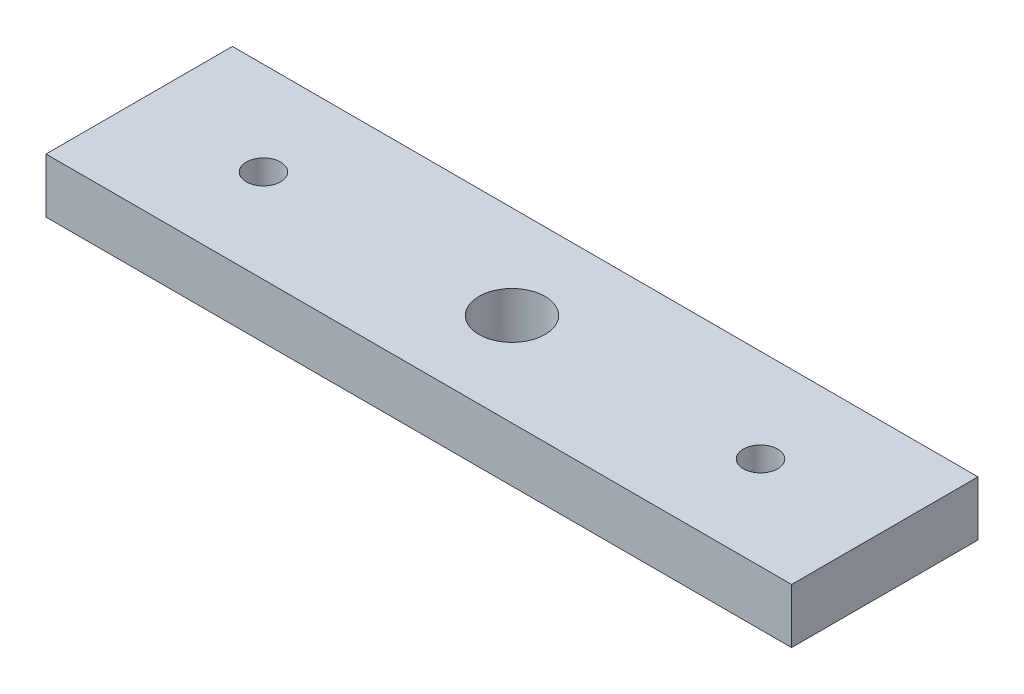
from build123d import *

# Parameters (mm, degrees)
SKETCH1_W                   = 76.2
SKETCH1_H                   = 19.05
BOSS_EXTRUDE1_DEPTH         = 5.588
F_1_4_CLEARANCE_HOLE1_D     = 6.7564
F_1_4_CLEARANCE_HOLE1_DEPTH = 19.05
F_1_4_CLEARANCE_HOLE1_TIP   = 2.029827343
F_6_CLEARANCE_HOLE1_D       = 3.5052


with BuildPart() as part:
    # Sketch1 → Boss-Extrude1 (new body)
    with BuildSketch(Plane(origin=(0, 0, 0), x_dir=(1, 0, 0), z_dir=(0, 1, 0))):
        Rectangle(SKETCH1_W, SKETCH1_H)
    extrude(amount=BOSS_EXTRUDE1_DEPTH)

    # 1/4 Clearance Hole1
    with Locations(Plane(origin=(0, 5.588, 0), x_dir=(1, 0, 0), z_dir=(0, 1, 0))):
        with Locations((0, 0)):
            Hole(F_1_4_CLEARANCE_HOLE1_D / 2, depth=F_1_4_CLEARANCE_HOLE1_DEPTH)
            with Locations((0, 0, -(F_1_4_CLEARANCE_HOLE1_DEPTH + F_1_4_CLEARANCE_HOLE1_TIP / 2))):  # 118° drill point
                Cone(0, F_1_4_CLEARANCE_HOLE1_D / 2, F_1_4_CLEARANCE_HOLE1_TIP, mode=Mode.SUBTRACT)

    # #6 Clearance Hole1 (through all)
    with Locations(Plane(origin=(0, 5.588, 0), x_dir=(1, 0, 0), z_dir=(0, 1, 0))):
        with Locations((25.4, 0), (-25.4, 0)):
            Hole(F_6_CLEARANCE_HOLE1_D / 2)


solid = part.part
